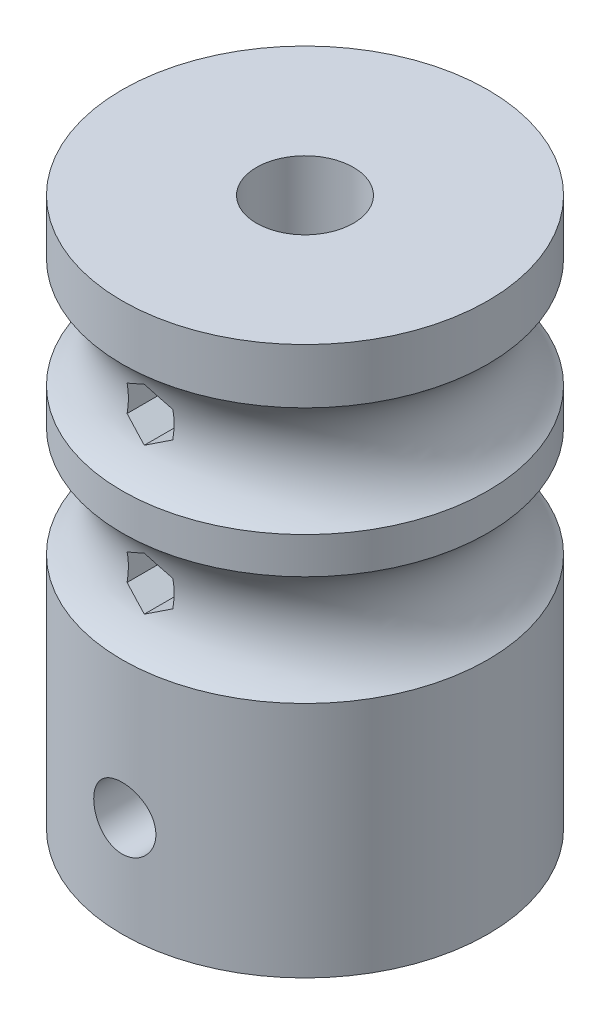
from build123d import *

# Parameters (mm, degrees)
CROQUIS1_R                 = 10
CROQUIS1_R_2               = 2.65
SALIENTE_EXTRUIR1_DEPTH    = 30
CROQUIS2_R                 = 1.7
CORTAR_EXTRUIR1_DEPTH      = 30
CROQUIS3_W                 = 6
CROQUIS3_H                 = 3
CORTAR_EXTRUIR2_DEPTH      = 9
CORTAR_EXTRUIR3_DEPTH      = 34.166248054
CORTAR_EXTRUIR3_DEPTH_BACK = 34.166248054


with BuildPart() as part:
    # Croquis1 → Saliente-Extruir1 (new body)
    with BuildSketch(Plane(origin=(0, 0, 0), x_dir=(1, 0, 0), z_dir=(0, 1, 0))):
        with Locations(Location((0, 0, 0), (0, 0, 270))):
            Circle(CROQUIS1_R)
        with Locations(Location((0, 0, 0), (0, 0, 270))):
            Circle(CROQUIS1_R_2, mode=Mode.SUBTRACT)
    extrude(amount=SALIENTE_EXTRUIR1_DEPTH)

    # Croquis2 → Cortar-Extruir1 (cut)
    with BuildSketch(Plane.XY):
        with Locations(Location((0, 5.5, 0), (0, 0, 180))):
            Circle(CROQUIS2_R)
    extrude(amount=CORTAR_EXTRUIR1_DEPTH, mode=Mode.SUBTRACT)

    # Croquis3 → Cortar-Extruir2 (cut)
    with BuildSketch(Plane(origin=(0, 0, 0), x_dir=(-1, 0, 0), z_dir=(0, -1, 0))):
        with Locations((0, -5.5)):
            Rectangle(CROQUIS3_W, CROQUIS3_H)
    extrude(amount=-CORTAR_EXTRUIR2_DEPTH, mode=Mode.SUBTRACT)

    # Croquis4 → Cortar-Extruir3 (cut, two sides: drawn at the far end of the back side and taken through both)
    with BuildSketch(Plane.XY.offset(-CORTAR_EXTRUIR3_DEPTH_BACK)):
        Polygon((0, 17.443375673), (-1.25, 16.721687836), (-1.25, 15.278312164), (0, 14.556624327), (1.25, 15.278312164), (1.25, 16.721687836), align=None)
        Polygon((0, 25.443375673), (-1.25, 24.721687836), (-1.25, 23.278312164), (0, 22.556624327), (1.25, 23.278312164), (1.25, 24.721687836), align=None)
    extrude(amount=CORTAR_EXTRUIR3_DEPTH + CORTAR_EXTRUIR3_DEPTH_BACK, mode=Mode.SUBTRACT)

    # Croquis5 → Cortar-Revolución1 (revolve, cut)
    with BuildSketch(Plane.XY, mode=Mode.PRIVATE) as cortar_revoluci_n1_sk:
        with BuildLine():
            Line((-10, 27), (-10, 21))
            ThreePointArc((-10, 21), (-8.5, 24), (-10, 27))
        make_face()
        with BuildLine():
            Line((-10, 19), (-10, 13))
            ThreePointArc((-10, 13), (-8.5, 16), (-10, 19))
        make_face()
    revolve(cortar_revoluci_n1_sk.sketch.rotate(Axis((0, 16, 0), (0, 1, 0)), 180), axis=Axis((0, 16, 0), (0, 1, 0)), mode=Mode.SUBTRACT)


solid = part.part
